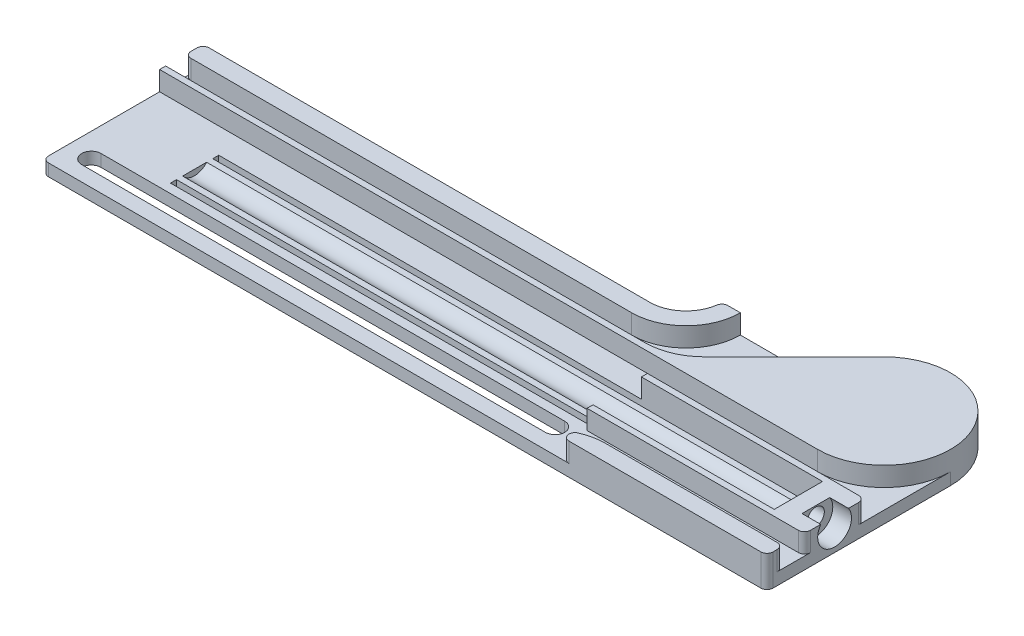
from build123d import *

# Parameters (mm, degrees)
BOSS_EXTRUDE2_DEPTH = 2
BOSS_EXTRUDE3_DEPTH = 3.2
BOSS_EXTRUDE4_START = 3.2
BOSS_EXTRUDE4_DEPTH = 3.2
SKETCH9_W           = 10
SKETCH9_H           = 3.2
BOSS_EXTRUDE5_DEPTH = 6
SKETCH8_R           = 2.8
CUT_EXTRUDE1_DEPTH  = 3.1
SKETCH10_R          = 1.4
CUT_EXTRUDE2_DEPTH  = 121.272440734
SKETCH11_R          = 2.55
CUT_EXTRUDE3_DEPTH  = 100
SKETCH12_W          = 30
SKETCH12_H          = 1
BOSS_EXTRUDE6_DEPTH = 3.2
SKETCH13_W          = 100
SKETCH13_H          = 1
CUT_EXTRUDE4_DEPTH  = 67.33136513
BOSS_EXTRUDE7_DEPTH = 3.2
CUT_EXTRUDE5_DEPTH  = 67.33136513
FILLET1_R           = 10
BOSS_EXTRUDE8_START = 2
BOSS_EXTRUDE8_DEPTH = 2
CUT_EXTRUDE6_DEPTH  = 67.33136513
FILLET2_R           = 1


with BuildPart() as part:
    # Sketch4 → Boss-Extrude2 (new body)
    with BuildSketch(Plane(origin=(0, 0, 0), x_dir=(1, 0, 0), z_dir=(0, 1, 0))):
        with BuildLine():
            Line((-60, -13.3), (60, -13.3))
            Line((60, -13.3), (60, 19.3))
            Line((60, 19.3), (20, 19.3))
            ThreePointArc((20, 19.3), (18.242640687, 15.057359313), (14, 13.3))
            Line((14, 13.3), (-60, 13.3))
            Line((-60, 13.3), (-60, -13.3))
        make_face()
    extrude(amount=-BOSS_EXTRUDE2_DEPTH)

    # Sketch5 → Boss-Extrude3 (add)
    with BuildSketch(Plane(origin=(0, 0, 0), x_dir=(1, 0, 0), z_dir=(0, 1, 0))):
        with BuildLine():
            Line((23.443650814, 7.1), (41.221825407, 24.878174593))
            ThreePointArc((41.221825407, 24.878174593), (59.162674858, 21.309517756), (49, 6.1))
            Line((49, 6.1), (-60, 6.1))
            Line((-60, 6.1), (-60, 7.1))
            Line((-60, 7.1), (23.443650814, 7.1))
        make_face()
    extrude(amount=BOSS_EXTRUDE3_DEPTH)

    # Sketch6 → Boss-Extrude4 (add)
    with BuildSketch(Plane(origin=(0, 0, 0), x_dir=(1, 0, 0), z_dir=(0, 1, 0)).offset(BOSS_EXTRUDE4_START)):
        with BuildLine():
            Line((-60, 10.3), (14, 10.3))
            ThreePointArc((14, 10.3), (20.363961031, 12.936038969), (23, 19.3))
            Line((23, 19.3), (20, 19.3))
            ThreePointArc((20, 19.3), (18.242640687, 15.057359313), (14, 13.3))
            Line((14, 13.3), (-60, 13.3))
            Line((-60, 13.3), (-60, 10.3))
        make_face()
    extrude(amount=-BOSS_EXTRUDE4_DEPTH)

    # Sketch9 → Boss-Extrude5 (add)
    with BuildSketch(Plane(origin=(60, 0, 0), x_dir=(0, 0, -1), z_dir=(1, 0, 0))):
        with Locations((-2.1, 1.6)):
            Rectangle(SKETCH9_W, SKETCH9_H)
    extrude(amount=-BOSS_EXTRUDE5_DEPTH)

    # Sketch8 → Cut-Extrude1 (cut)
    with BuildSketch(Plane(origin=(60, 0, 0), x_dir=(0, 0, -1), z_dir=(1, 0, 0))):
        with Locations((-2.1, 1.6)):
            Circle(SKETCH8_R)
    extrude(amount=-CUT_EXTRUDE1_DEPTH, mode=Mode.SUBTRACT)

    # Sketch10 → Cut-Extrude2 (cut, through all)
    with BuildSketch(Plane(origin=(56.9, 0, 0), x_dir=(0, 0, -1), z_dir=(1, 0, 0))):
        with Locations((-2.1, 1.6)):
            Circle(SKETCH10_R)
    extrude(amount=-CUT_EXTRUDE2_DEPTH, mode=Mode.SUBTRACT)

    # Sketch11 → Cut-Extrude3 (cut)
    with BuildSketch(Plane.ZY.offset(-54)):
        with Locations((2.1, 1.6)):
            Circle(SKETCH11_R)
    extrude(amount=CUT_EXTRUDE3_DEPTH, mode=Mode.SUBTRACT)

    # Sketch12 → Boss-Extrude6 (add)
    with BuildSketch(Plane(origin=(0, 0, 0), x_dir=(1, 0, 0), z_dir=(0, 1, 0))):
        with Locations((39, 2.4)):
            Rectangle(SKETCH12_W, SKETCH12_H)
    boss_extrude6 = extrude(amount=BOSS_EXTRUDE6_DEPTH)

    # Sketch13 → Cut-Extrude4 (cut, through all)
    with BuildSketch(Plane(origin=(0, 0, 0), x_dir=(1, 0, 0), z_dir=(0, 1, 0))):
        with Locations((4, 1.4)):
            Rectangle(SKETCH13_W, SKETCH13_H)
    cut_extrude4 = extrude(amount=-CUT_EXTRUDE4_DEPTH, mode=Mode.SUBTRACT)

    # Mirror1: Boss-Extrude6, Cut-Extrude4 across plane
    add(boss_extrude6.mirror(Plane.XY.offset(2.1)))
    add(cut_extrude4.mirror(Plane.XY.offset(2.1)), mode=Mode.SUBTRACT)

    # Sketch14 → Boss-Extrude7 (add)
    with BuildSketch(Plane(origin=(0, 0, 0), x_dir=(1, 0, 0), z_dir=(0, 1, 0))):
        with BuildLine():
            Line((60, -10.6), (30.518376618, -10.6))
            ThreePointArc((30.518376618, -10.6), (26.990656613, -11.301707138), (24, -13.3))
            Line((24, -13.3), (60, -13.3))
            Line((60, -13.3), (60, -10.6))
        make_face()
    extrude(amount=BOSS_EXTRUDE7_DEPTH)

    # Sketch15 → Cut-Extrude5 (cut, through all)
    with BuildSketch(Plane(origin=(0, 0, 0), x_dir=(1, 0, 0), z_dir=(0, 1, 0))):
        with BuildLine():
            Line((-56, -7.6), (20.8, -7.6))
            ThreePointArc((20.8, -7.6), (22.4, -9.2), (20.8, -10.8))
            Line((20.8, -10.8), (-56, -10.8))
            ThreePointArc((-56, -10.8), (-57.6, -9.2), (-56, -7.6))
        make_face()
    extrude(amount=-CUT_EXTRUDE5_DEPTH, mode=Mode.SUBTRACT)

    # Fillet1
    fillet1_edges = [part.edges().sort_by_distance(p)[0] for p in [
        (23.443650814, 1.6, -7.1),
    ]]
    fillet(fillet1_edges, radius=FILLET1_R)

    # Sketch16 → Boss-Extrude8 (add)
    with BuildSketch(Plane.XZ.offset(BOSS_EXTRUDE8_START)):
        with BuildLine():
            Line((59.777754868, -19.3), (35.643650814, -19.3))
            Line((35.643650814, -19.3), (41.221825407, -24.878174593))
            ThreePointArc((41.221825407, -24.878174593), (52.166761501, -27.634306887), (59.777754868, -19.3))
        make_face()
    extrude(amount=-BOSS_EXTRUDE8_DEPTH)

    # Sketch17 → Cut-Extrude6 (cut, through all)
    with BuildSketch(Plane(origin=(0, 0, 0), x_dir=(1, 0, 0), z_dir=(0, 1, 0))):
        with BuildLine():
            Line((60, 17.1), (60, 19.3))
            Line((60, 19.3), (59.777754868, 19.3))
            ThreePointArc((59.777754868, 19.3), (59.944297683, 18.205598582), (60, 17.1))
        make_face()
    extrude(amount=-CUT_EXTRUDE6_DEPTH, mode=Mode.SUBTRACT)

    # Fillet2
    fillet2_edges = [part.edges().sort_by_distance(p)[0] for p in [
        (-60, 0.6, -13.3),
        (20, 0.6, -19.3),
        (60, 0.6, 13.3),
        (-60, -1, 13.3),
        (60, 1.6, 10.6),
        (24, 1.6, 13.3),
        (35.643650814, -1, -19.3),
        (-60, 1.6, -10.3),
        (60, 1.6, -2.9),
        (60, 1.6, 7.1),
    ]]
    fillet(fillet2_edges, radius=FILLET2_R)


solid = part.part
